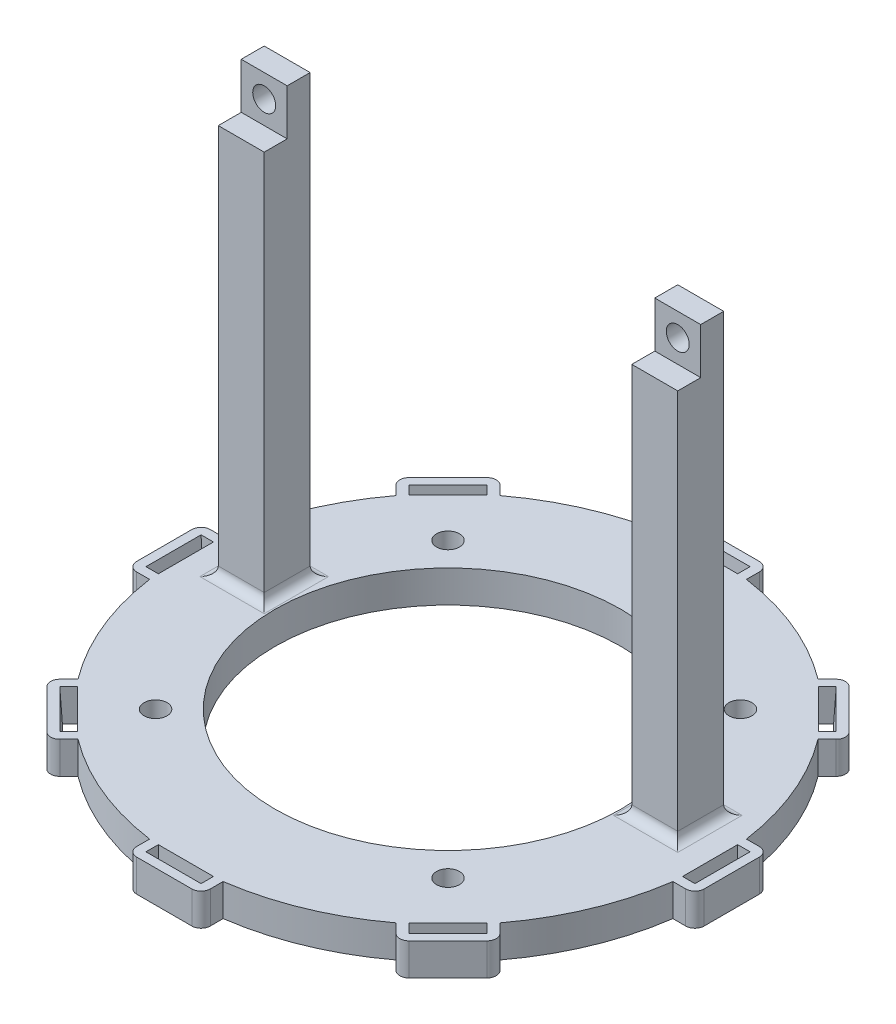
from build123d import *

# Parameters (mm, degrees)
BOSS_EXTRUDE1_DEPTH = 7
SKETCH3_R           = 37.663730654
CUT_EXTRUDE1_DEPTH  = 88.594763353
CIRPATTERN1_COUNT   = 8
SKETCH8_W           = 10
SKETCH8_H           = 10
BOSS_EXTRUDE2_DEPTH = 95
SKETCH9_W           = 10
SKETCH9_H           = 10
SKETCH9_R           = 2.5
CUT_EXTRUDE2_DEPTH  = 5
CUT_EXTRUDE3_DEPTH  = 135.267801676
SKETCH11_R          = 2.5
CUT_EXTRUDE4_DEPTH  = 135.267801676
CIRPATTERN2_COUNT   = 4
FILLET1_R           = 2


with BuildPart() as part:
    # Sketch1 → Boss-Extrude1 (new body)
    with BuildSketch(Plane(origin=(0, 0, 0), x_dir=(1, 0, 0), z_dir=(0, 1, 0))):
        with BuildLine():
            Line((-8, 56.940758688), (-8, 59.740758688))
            ThreePointArc((-8, 59.740758688), (-7.414213562, 61.154972251), (-6, 61.740758688))
            Line((-6, 61.740758688), (6, 61.740758688))
            ThreePointArc((6, 61.740758688), (7.414213562, 61.154972251), (8, 59.740758688))
            Line((8, 59.740758688), (8, 56.940758688))
            ThreePointArc((8, 56.940758688), (22.004297361, 53.123073119), (34.606342345, 45.920050844))
            Line((34.606342345, 45.920050844), (36.586241332, 47.899949831))
            ThreePointArc((36.586241332, 47.899949831), (38.000454895, 48.485736269), (39.414668457, 47.899949831))
            Line((39.414668457, 47.899949831), (47.899949831, 39.414668457))
            ThreePointArc((47.899949831, 39.414668457), (48.485736269, 38.000454895), (47.899949831, 36.586241332))
            Line((47.899949831, 36.586241332), (45.920050844, 34.606342345))
            ThreePointArc((45.920050844, 34.606342345), (53.123073119, 22.004297361), (56.940758688, 8))
            Line((56.940758688, 8), (59.740758688, 8))
            ThreePointArc((59.740758688, 8), (61.154972251, 7.414213562), (61.740758688, 6))
            Line((61.740758688, 6), (61.740758688, -6))
            ThreePointArc((61.740758688, -6), (61.154972251, -7.414213562), (59.740758688, -8))
            Line((59.740758688, -8), (56.940758688, -8))
            ThreePointArc((56.940758688, -8), (53.123073119, -22.004297361), (45.920050844, -34.606342345))
            Line((45.920050844, -34.606342345), (47.899949831, -36.586241332))
            ThreePointArc((47.899949831, -36.586241332), (48.485736269, -38.000454895), (47.899949831, -39.414668457))
            Line((47.899949831, -39.414668457), (39.414668457, -47.899949831))
            ThreePointArc((39.414668457, -47.899949831), (38.000454895, -48.485736269), (36.586241332, -47.899949831))
            Line((36.586241332, -47.899949831), (34.606342345, -45.920050844))
            ThreePointArc((34.606342345, -45.920050844), (22.004297361, -53.123073119), (8, -56.940758688))
            Line((8, -56.940758688), (8, -59.740758688))
            ThreePointArc((8, -59.740758688), (7.414213562, -61.154972251), (6, -61.740758688))
            Line((6, -61.740758688), (-6, -61.740758688))
            ThreePointArc((-6, -61.740758688), (-7.414213562, -61.154972251), (-8, -59.740758688))
            Line((-8, -59.740758688), (-8, -56.940758688))
            ThreePointArc((-8, -56.940758688), (-22.004297361, -53.123073119), (-34.606342345, -45.920050844))
            Line((-34.606342345, -45.920050844), (-36.586241332, -47.899949831))
            ThreePointArc((-36.586241332, -47.899949831), (-38.000454895, -48.485736269), (-39.414668457, -47.899949831))
            Line((-39.414668457, -47.899949831), (-47.899949831, -39.414668457))
            ThreePointArc((-47.899949831, -39.414668457), (-48.485736269, -38.000454895), (-47.899949831, -36.586241332))
            Line((-47.899949831, -36.586241332), (-45.920050844, -34.606342345))
            ThreePointArc((-45.920050844, -34.606342345), (-53.123073119, -22.004297361), (-56.940758688, -8))
            Line((-56.940758688, -8), (-59.740758688, -8))
            ThreePointArc((-59.740758688, -8), (-61.154972251, -7.414213562), (-61.740758688, -6))
            Line((-61.740758688, -6), (-61.740758688, 6))
            ThreePointArc((-61.740758688, 6), (-61.154972251, 7.414213562), (-59.740758688, 8))
            Line((-59.740758688, 8), (-56.940758688, 8))
            ThreePointArc((-56.940758688, 8), (-53.123073119, 22.004297361), (-45.920050844, 34.606342345))
            Line((-45.920050844, 34.606342345), (-47.899949831, 36.586241332))
            ThreePointArc((-47.899949831, 36.586241332), (-48.485736269, 38.000454895), (-47.899949831, 39.414668457))
            Line((-47.899949831, 39.414668457), (-39.414668457, 47.899949831))
            ThreePointArc((-39.414668457, 47.899949831), (-38.000454895, 48.485736269), (-36.586241332, 47.899949831))
            Line((-36.586241332, 47.899949831), (-34.606342345, 45.920050844))
            ThreePointArc((-34.606342345, 45.920050844), (-22.004297361, 53.123073119), (-8, 56.940758688))
        make_face()
    extrude(amount=BOSS_EXTRUDE1_DEPTH)

    # Sketch3 → Cut-Extrude1 (cut, through all)
    with BuildSketch(Plane(origin=(0, 7, 0), x_dir=(1, 0, 0), z_dir=(0, 1, 0))):
        with Locations(Location((0, 0, 0), (0, 0, 270))):
            Circle(SKETCH3_R)
    extrude(amount=-CUT_EXTRUDE1_DEPTH, mode=Mode.SUBTRACT)

    # Sketch7 → Cut-Loft1 section 0
    with BuildSketch(Plane.XZ):
        with BuildLine():
            Line((-6, -57.040758688), (6, -57.040758688))
            Line((6, -57.040758688), (6, -59.340758688))
            Line((6, -59.340758688), (-6, -59.340758688))
            Line((-6, -59.340758688), (-6, -57.040758688))
        make_face()
    # Sketch5 → Cut-Loft1 section 1
    with BuildSketch(Plane(origin=(0, 7, 0), x_dir=(1, 0, 0), z_dir=(0, 1, 0))):
        with BuildLine():
            Line((-6, 59.740758688), (6, 59.740758688))
            Line((6, 59.740758688), (6, 57.040758688))
            Line((6, 57.040758688), (-6, 57.040758688))
            Line((-6, 57.040758688), (-6, 59.740758688))
        make_face()
    cut_loft1 = loft(mode=Mode.SUBTRACT)

    # CirPattern1: Cut-Loft1 ×8 about axis
    cirpattern1_axis = Axis((0, 0, 0), (0, 1, 0))
    for i in range(1, CIRPATTERN1_COUNT):
        add(cut_loft1.rotate(cirpattern1_axis, i * 360 / CIRPATTERN1_COUNT), mode=Mode.SUBTRACT)

    # Sketch8 → Boss-Extrude2 (add)
    with BuildSketch(Plane(origin=(0, 7, 0), x_dir=(1, 0, 0), z_dir=(0, 1, 0))):
        with Locations((45, 5)):
            Rectangle(SKETCH8_W, SKETCH8_H)
        with Locations((-45, 5)):
            Rectangle(SKETCH8_W, SKETCH8_H)
    extrude(amount=BOSS_EXTRUDE2_DEPTH)

    # Sketch9 → Cut-Extrude2 (cut)
    with BuildSketch(Plane.XY):
        with Locations((-45, 97)):
            Rectangle(SKETCH9_W, SKETCH9_H)
        with Locations((-45, 97)):
            Circle(SKETCH9_R, mode=Mode.SUBTRACT)
    cut_extrude2 = extrude(amount=-CUT_EXTRUDE2_DEPTH, mode=Mode.SUBTRACT)

    # Sketch9<2> → Cut-Extrude3 (cut, through all)
    with BuildSketch(Plane.XY):
        with BuildLine():
            ThreePointArc((-42.5, 97), (-42.690301169, 97.956708581), (-43.232233047, 98.767766953))
            Line((-43.232233047, 98.767766953), (-46.767766953, 95.232233047))
            ThreePointArc((-46.767766953, 95.232233047), (-44.043291419, 94.690301169), (-42.5, 97))
        make_face()
        with BuildLine():
            Line((-46.767766953, 95.232233047), (-43.232233047, 98.767766953))
            ThreePointArc((-43.232233047, 98.767766953), (-46.767766953, 98.767766953), (-46.767766953, 95.232233047))
        make_face()
    cut_extrude3 = extrude(amount=-CUT_EXTRUDE3_DEPTH, mode=Mode.SUBTRACT)

    # Mirror1: Cut-Extrude2, Cut-Extrude3 across plane
    add(cut_extrude2.mirror(Plane(origin=(0, 0, 0), x_dir=(0, 0, 1), z_dir=(1, 0, 0))), mode=Mode.SUBTRACT)
    add(cut_extrude3.mirror(Plane(origin=(0, 0, 0), x_dir=(0, 0, 1), z_dir=(1, 0, 0))), mode=Mode.SUBTRACT)

    # Sketch11 → Cut-Extrude4 (cut, through all)
    with BuildSketch(Plane.XZ):
        with Locations(Location((-31.819805153, -31.819805153, 0), (0, 0, 270))):
            Circle(SKETCH11_R)
    cut_extrude4 = extrude(amount=-CUT_EXTRUDE4_DEPTH, mode=Mode.SUBTRACT)

    # CirPattern2: Cut-Extrude4 ×4 about axis
    cirpattern2_axis = Axis((0, 0, 0), (0, 1, 0))
    for i in range(1, CIRPATTERN2_COUNT):
        add(cut_extrude4.rotate(cirpattern2_axis, i * 360 / CIRPATTERN2_COUNT), mode=Mode.SUBTRACT)

    # Fillet1
    fillet1_edges = [part.edges().sort_by_distance(p)[0] for p in [
        (50, 7, -5),
        (45, 7, -10),
        (40, 7, -5),
        (45, 7, 0),
        (-45, 7, -10),
        (-50, 7, -5),
        (-45, 7, 0),
        (-40, 7, -5),
    ]]
    fillet(fillet1_edges, radius=FILLET1_R)


solid = part.part
